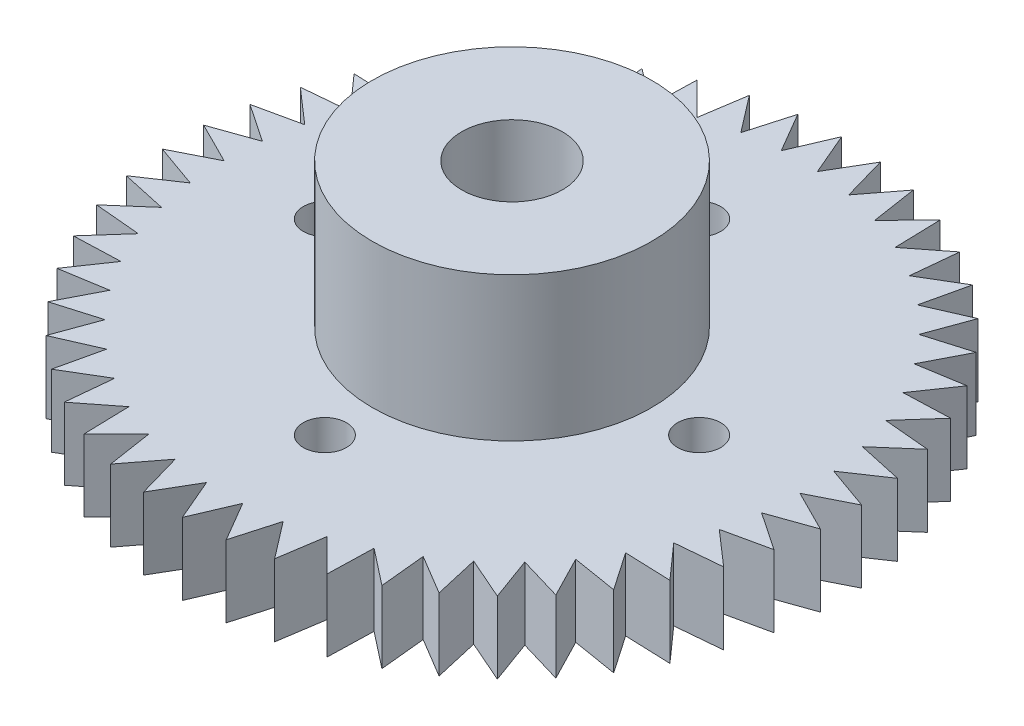
from build123d import *

# Parameters (mm, degrees)
SKETCH_1_R          = 20
EXTRUDE_1_DEPTH     = 5
SKETCH_2_R          = 9.7
EXTRUDE_2_DEPTH     = 10
SKETCH_3_R          = 3.5
CUT_EXTRUDE_1_DEPTH = 15
SKETCH_6_R          = 1.5
CUT_EXTRUDE_2_DEPTH = 15
EXTRUDE_3_DEPTH     = 5
SKETCH_13_R         = 1.5
CUT_EXTRUDE_3_DEPTH = 36.661638146


with BuildPart() as part:
    # 草图1 → 凸台-拉伸1 (new body)
    with BuildSketch(Plane(origin=(0, 0, 0), x_dir=(1, 0, 0), z_dir=(0, 1, 0))):
        with Locations(Location((0, 0, 0), (0, 0, 270))):
            Circle(SKETCH_1_R)
    extrude(amount=EXTRUDE_1_DEPTH)

    # 草图2 → 凸台-拉伸2 (add)
    with BuildSketch(Plane(origin=(0, 5, 0), x_dir=(1, 0, 0), z_dir=(0, 1, 0))):
        with Locations(Location((0, 0, 0), (0, 0, 270))):
            Circle(SKETCH_2_R)
    extrude(amount=EXTRUDE_2_DEPTH)

    # 草图3 → 切除-拉伸1 (cut)
    with BuildSketch(Plane(origin=(0, 15, 0), x_dir=(1, 0, 0), z_dir=(0, 1, 0))):
        with Locations(Location((0, 0, 0), (0, 0, 270))):
            Circle(SKETCH_3_R)
    extrude(amount=-CUT_EXTRUDE_1_DEPTH, mode=Mode.SUBTRACT)

    # 草图6 → 切除-拉伸2 (cut)
    with BuildSketch(Plane(origin=(0, 5, 0), x_dir=(1, 0, 0), z_dir=(0, 1, 0))):
        with Locations(Location((-13, 0, 0), (0, 0, 270))):
            Circle(SKETCH_6_R)
        with Locations(Location((0, 13, 0), (0, 0, 270))):
            Circle(SKETCH_6_R)
        with Locations(Location((13, 0, 0), (0, 0, 270))):
            Circle(SKETCH_6_R)
        with Locations(Location((0, -13, 0), (0, 0, 270))):
            Circle(SKETCH_6_R)
    extrude(amount=-CUT_EXTRUDE_2_DEPTH, mode=Mode.SUBTRACT)

    # 草图12 → 凸台-拉伸3 (add)
    with BuildSketch(Plane(origin=(0, 0, 0), x_dir=(1, 0, 0), z_dir=(0, 1, 0))):
        Polygon((-1.255810391, 19.960534569), (0, 22.9), (1.255810391, 19.960534569), (2.870131049, 22.71942666), (3.747626292, 19.645745015), (5.694998416, 22.18055439), (6.180339887, 19.021130326), (8.430052256, 21.291881527), (8.515585831, 18.096541049), (11.032159137, 20.067422973), (10.7165359, 16.88655851), (13.460282277, 18.526489171), (12.748479795, 15.410264856), (15.676128726, 16.693381568), (14.579372548, 13.690942119), (17.64475326, 14.597009365), (16.180339887, 11.755705046), (19.335109494, 12.270433605), (17.526133601, 9.635073482), (20.720539501, 9.750345777), (18.595529718, 7.362491054), (21.779194223, 7.076489171), (19.371663223, 4.973797743), (22.494378042, 4.291032104), (19.842294026, 2.506664671), (22.854812081, 1.437902897), (20, 0), (22.854812081, -1.437902897), (19.842294026, -2.506664671), (22.494378042, -4.291032104), (19.371663223, -4.973797743), (21.779194223, -7.076489171), (18.595529718, -7.362491054), (20.720539501, -9.750345777), (17.526133601, -9.635073482), (19.335109494, -12.270433605), (16.180339887, -11.755705046), (17.64475326, -14.597009365), (14.579372548, -13.690942119), (15.676128726, -16.693381568), (12.748479795, -15.410264856), (13.460282277, -18.526489171), (10.7165359, -16.88655851), (11.032159137, -20.067422973), (8.515585831, -18.096541049), (8.430052256, -21.291881527), (6.180339887, -19.021130326), (5.694998416, -22.18055439), (3.747626292, -19.645745015), (2.870131049, -22.71942666), (1.255810391, -19.960534569), (0, -22.9), (-1.255810391, -19.960534569), (-2.870131049, -22.71942666), (-3.747626292, -19.645745015), (-5.694998416, -22.18055439), (-6.180339887, -19.021130326), (-8.430052256, -21.291881527), (-8.515585831, -18.096541049), (-11.032159137, -20.067422973), (-10.7165359, -16.88655851), (-13.460282277, -18.526489171), (-12.748479795, -15.410264856), (-15.676128726, -16.693381568), (-14.579372548, -13.690942119), (-17.64475326, -14.597009365), (-16.180339887, -11.755705046), (-19.335109494, -12.270433605), (-17.526133601, -9.635073482), (-20.720539501, -9.750345777), (-18.595529718, -7.362491054), (-21.779194223, -7.076489171), (-19.371663223, -4.973797743), (-22.494378042, -4.291032104), (-19.842294026, -2.506664671), (-22.854812081, -1.437902897), (-20, 0), (-22.854812081, 1.437902897), (-19.842294026, 2.506664671), (-22.494378042, 4.291032104), (-19.371663223, 4.973797743), (-21.779194223, 7.076489171), (-18.595529718, 7.362491054), (-20.720539501, 9.750345777), (-17.526133601, 9.635073482), (-19.335109494, 12.270433605), (-16.180339887, 11.755705046), (-17.64475326, 14.597009365), (-14.579372548, 13.690942119), (-15.676128726, 16.693381568), (-12.748479795, 15.410264856), (-13.460282277, 18.526489171), (-10.7165359, 16.88655851), (-11.032159137, 20.067422973), (-8.515585831, 18.096541049), (-8.430052256, 21.291881527), (-6.180339887, 19.021130326), (-5.694998416, 22.18055439), (-3.747626292, 19.645745015), (-2.870131049, 22.71942666), align=None)
    extrude(amount=EXTRUDE_3_DEPTH)

    # 草图13 → 切除-拉伸3 (cut, through all)
    with BuildSketch(Plane(origin=(0, 15, 0), x_dir=(1, 0, 0), z_dir=(0, 1, 0))):
        with Locations(Location((0, 13, 0), (0, 0, 270))):
            Circle(SKETCH_13_R)
        with Locations(Location((13, 0, 0), (0, 0, 270))):
            Circle(SKETCH_13_R)
        with Locations(Location((0, -13, 0), (0, 0, 270))):
            Circle(SKETCH_13_R)
        with Locations(Location((-13, 0, 0), (0, 0, 270))):
            Circle(SKETCH_13_R)
    extrude(amount=-CUT_EXTRUDE_3_DEPTH, mode=Mode.SUBTRACT)


solid = part.part
